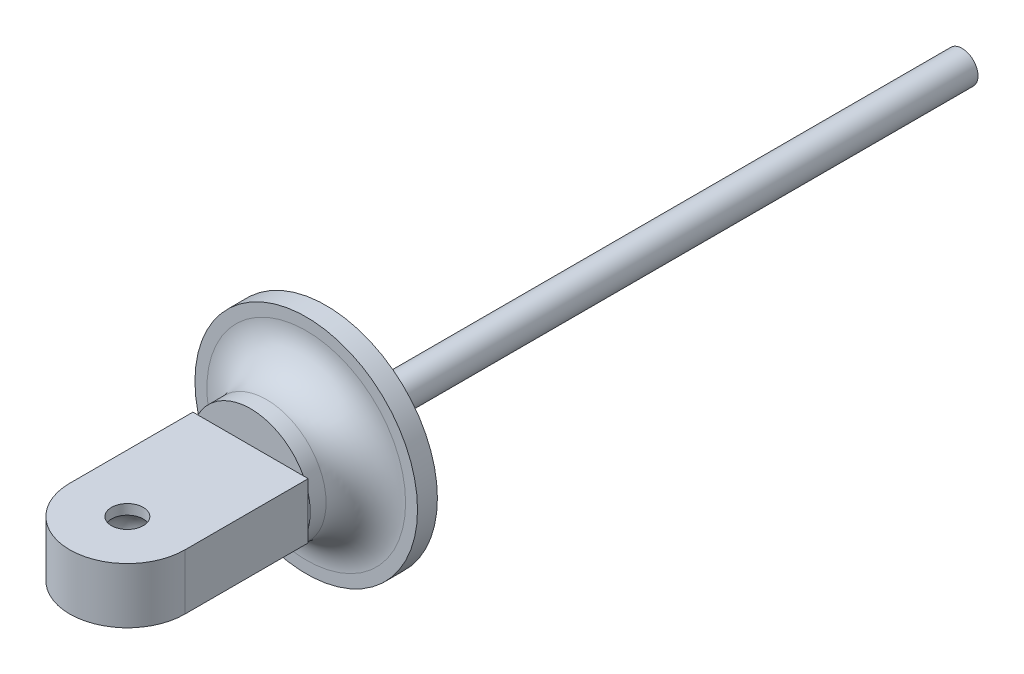
from build123d import *

# Parameters (mm, degrees)
SKETCH_1_R          = 2
EXTRUDE_1_DEPTH     = 80
SKETCH_2_R          = 14
EXTRUDE_2_DEPTH     = 2.5
SKETCH_3_R          = 7.5
EXTRUDE_3_DEPTH     = 7
FILLET_1_R          = 5
SKETCH_4_R          = 7.25
EXTRUDE_4_DEPTH     = 3.5
SKETCH_5_R          = 2
CUT_EXTRUDE_1_DEPTH = 7


with BuildPart() as part:
    # 草图1 → 凸台-拉伸1 (new body)
    with BuildSketch(Plane.XY):
        Circle(SKETCH_1_R)
    extrude(amount=EXTRUDE_1_DEPTH)

    # 草图2 → 凸台-拉伸2 (add)
    with BuildSketch(Plane.XY.offset(80)):
        Circle(SKETCH_2_R)
    extrude(amount=EXTRUDE_2_DEPTH)

    # 草图3 → 凸台-拉伸3 (add)
    with BuildSketch(Plane.XY.offset(82.5)):
        Circle(SKETCH_3_R)
    extrude(amount=EXTRUDE_3_DEPTH)

    # 圆角1
    fillet_1_edges = [part.edges().sort_by_distance(p)[0] for p in [
        (-7.5, 0, 82.5),
    ]]
    fillet(fillet_1_edges, radius=FILLET_1_R)

    # 草图4 → 凸台-拉伸4 (add, symmetric)
    with BuildSketch(Plane(origin=(0, 0, 0), x_dir=(1, 0, 0), z_dir=(0, 1, 0))):
        with BuildLine():
            ThreePointArc((-7.25, -105), (0, -97.75), (7.25, -105))
            Line((7.25, -105), (7.25, -89.5))
            Line((7.25, -89.5), (-7.25, -89.5))
            Line((-7.25, -89.5), (-7.25, -105))
        make_face()
        with Locations((0, -105)):
            Circle(SKETCH_4_R)
    extrude(amount=EXTRUDE_4_DEPTH, both=True)

    # 草图5 → 切除-拉伸1 (cut)
    with BuildSketch(Plane.XZ.offset(3.5)):
        with Locations(Location((0, 105, 0), (0, 0, 270))):
            Circle(SKETCH_5_R)
    extrude(amount=-CUT_EXTRUDE_1_DEPTH, mode=Mode.SUBTRACT)

    # 草图6 → 切除-旋转1 (revolve, cut)
    with BuildSketch(Plane(origin=(0, 0, 0), x_dir=(1, 0, 0), z_dir=(0, 1, 0))):
        with BuildLine():
            Line((0, -102), (0, -108))
            ThreePointArc((0, -108), (3, -105), (0, -102))
        make_face()
    revolve(axis=Axis((0, 0, 112.25), (0, 0, -1)), mode=Mode.SUBTRACT)


solid = part.part
